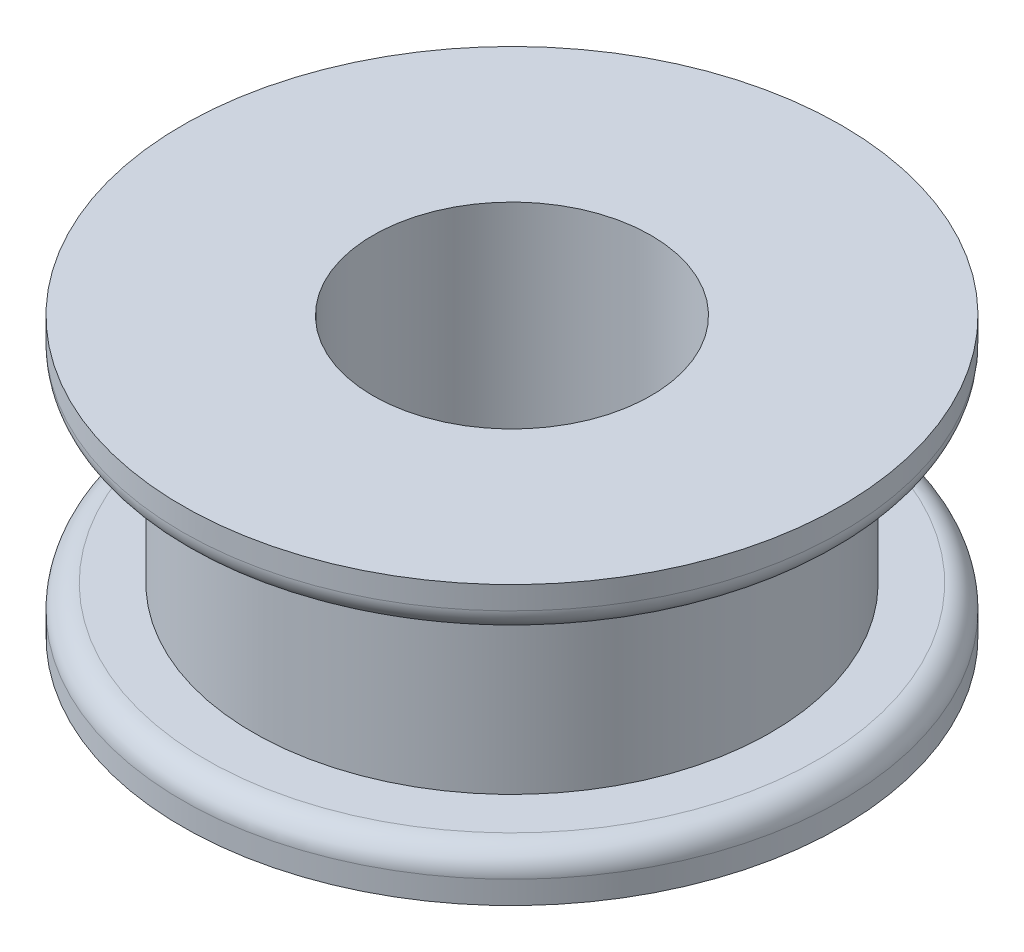
from build123d import *

# Parameters (mm, degrees)
FILLET1_R = 0.508


with BuildPart() as part:
    # Sketch1 → Revolve1 (revolve)
    with BuildSketch(Plane.YZ, mode=Mode.PRIVATE) as revolve1_sk:
        Polygon((0, 3.000000096), (-6.000000192, 3.000000096), (-6.000000192, 7.112), (-5.00000016, 7.112), (-5.00000016, 5.588), (-1.000000032, 5.588), (-1.000000032, 7.112), (0, 7.112), align=None)
    revolve(revolve1_sk.sketch.rotate(Axis((0, -39.041586513, 0), (0, 1, 0)), 180), axis=Axis((0, -39.041586513, 0), (0, 1, 0)))

    # Fillet1
    fillet1_edges = [part.edges().sort_by_distance(p)[0] for p in [
        (0, -1.000000032, 7.112),
        (0, -5.00000016, 7.112),
    ]]
    fillet(fillet1_edges, radius=FILLET1_R)


solid = part.part
